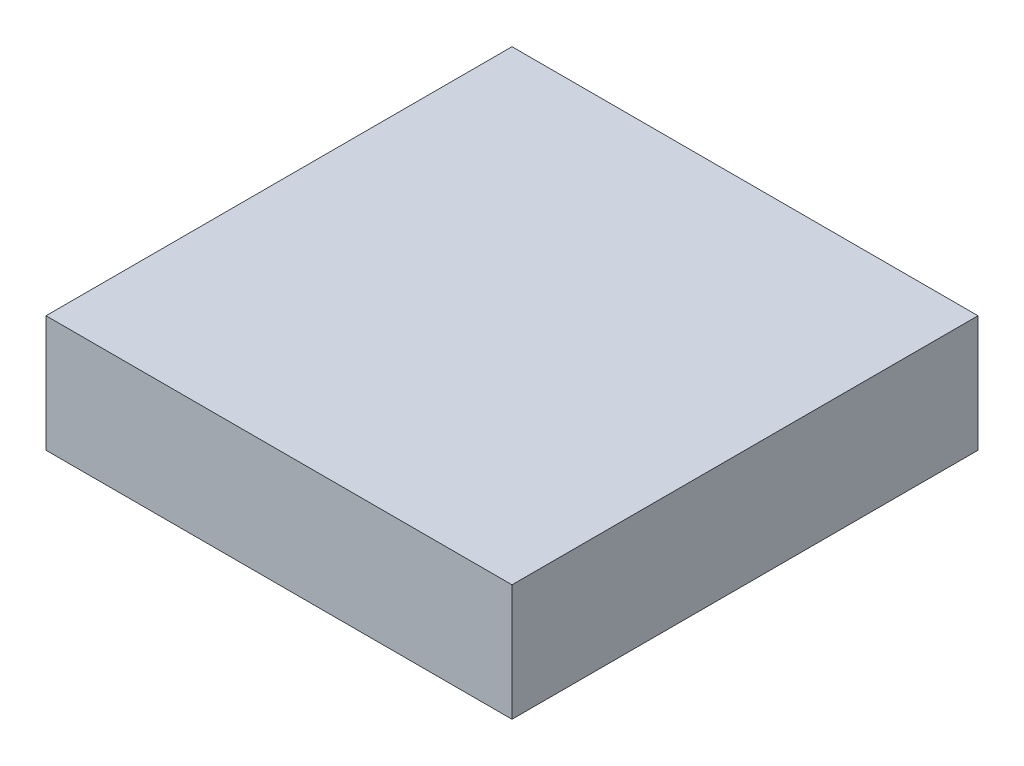
from build123d import *

# Parameters (mm, degrees)
CROQUIS1_W              = 101.6
CROQUIS1_H              = 101.6
SALIENTE_EXTRUIR1_DEPTH = 25.4


with BuildPart() as part:
    # Croquis1 → Saliente-Extruir1 (new body)
    with BuildSketch(Plane(origin=(0, 0, 0), x_dir=(1, 0, 0), z_dir=(0, 1, 0))):
        with Locations((1.387978142, 19.986885246)):
            Rectangle(CROQUIS1_W, CROQUIS1_H)
    extrude(amount=SALIENTE_EXTRUIR1_DEPTH)


solid = part.part
